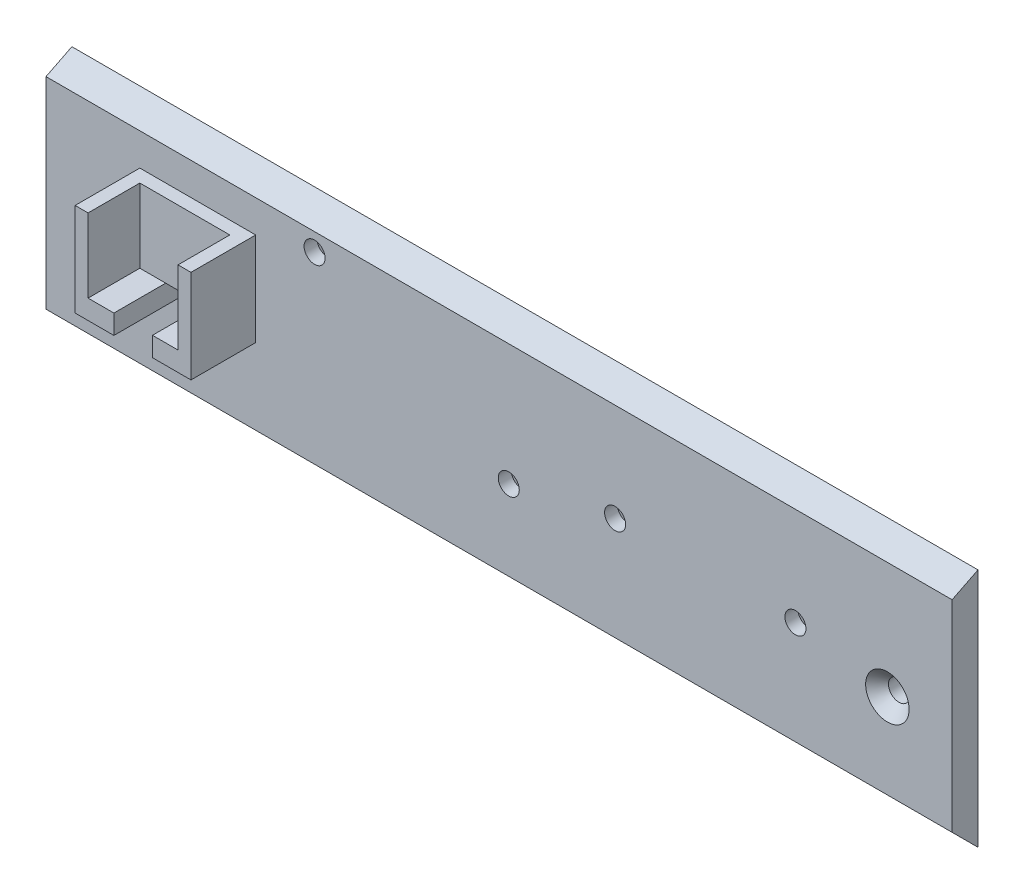
from build123d import *

# Parameters (mm, degrees)
CROQUIS1_W                      = 140
CROQUIS1_H                      = 37.125
CROQUIS1_R                      = 1.625
SALIENTE_EXTRUIR1_DEPTH         = 4
CROQUIS2_R                      = 3.35997123
CORTAR_EXTRUIR1_DEPTH           = 1.8
CORTAR_EXTRUIR1_DRAFT           = -44
CORTAR_EXTRUIR1_PROFILE_2_DEPTH = 1.8
CORTAR_EXTRUIR1_PROFILE_2_DRAFT = -44
CROQUIS3_R                      = 1.625
CORTAR_EXTRUIR2_DEPTH           = 4
SALIENTE_EXTRUIR2_DEPTH         = 10
CROQUIS6_W                      = 13.9
CROQUIS6_H                      = 11.4
SALIENTE_EXTRUIR4_DEPTH         = 2
CORTAR_EXTRUIR3_DEPTH           = 2
CORTAR_EXTRUIR4_START           = -140
CORTAR_EXTRUIR4_DEPTH           = 140


with BuildPart() as part:
    # Croquis1 → Saliente-Extruir1 (new body)
    with BuildSketch(Plane.XY):
        with Locations((62.679008317, -85.846623552)):
            Rectangle(CROQUIS1_W, CROQUIS1_H)
        with Locations((122.679008317, -87.284123552)):
            Circle(CROQUIS1_R, mode=Mode.SUBTRACT)
        with Locations((2.679008317, -87.284123552)):
            Circle(CROQUIS1_R, mode=Mode.SUBTRACT)
    extrude(amount=SALIENTE_EXTRUIR1_DEPTH)


with BuildPart() as cortar_extruir1_tool:
    # Croquis2 → Cortar-Extruir1 (with draft: the straight prism first)
    with BuildSketch(Plane.XY.offset(4)):
        with Locations((2.679008317, -87.284123552)):
            Circle(CROQUIS2_R)
    extrude(amount=-CORTAR_EXTRUIR1_DEPTH)
    # Cortar-Extruir1: the draft: its side faces are tilted about the plane it starts from
    cortar_extruir1_sides = [cortar_extruir1_tool.faces().sort_by_distance(p)[0] for p in [
        (-0.680962913, -87.284123552, 3.1),
    ]]
    draft(cortar_extruir1_sides, Plane.XY.offset(4), CORTAR_EXTRUIR1_DRAFT)


with BuildPart() as part_1:
    add(part.part)

    # Cortar-Extruir1: cut by cortar_extruir1_tool
    add(cortar_extruir1_tool.part, mode=Mode.SUBTRACT)


with BuildPart() as cortar_extruir1_profile_2_tool:
    # Croquis2 → Cortar-Extruir1 profile 2 (with draft: the straight prism first)
    with BuildSketch(Plane.XY.offset(4)):
        with Locations((122.679008317, -87.284123552)):
            Circle(CROQUIS2_R)
    extrude(amount=-CORTAR_EXTRUIR1_PROFILE_2_DEPTH)
    # Cortar-Extruir1 profile 2: the draft: its side faces are tilted about the plane it starts from
    cortar_extruir1_profile_2_sides = [cortar_extruir1_profile_2_tool.faces().sort_by_distance(p)[0] for p in [
        (119.319037087, -87.284123552, 3.1),
    ]]
    draft(cortar_extruir1_profile_2_sides, Plane.XY.offset(4), CORTAR_EXTRUIR1_PROFILE_2_DRAFT)


with BuildPart() as part_2:
    add(part_1.part)

    # Cortar-Extruir1 profile 2: cut by cortar_extruir1_profile_2_tool
    add(cortar_extruir1_profile_2_tool.part, mode=Mode.SUBTRACT)

    # Croquis3 → Cortar-Extruir2 (cut)
    with BuildSketch(Plane.XY.offset(4)):
        with Locations((80.609008317, -84.449123552)):
            Circle(CROQUIS3_R)
        with Locations((108.469008317, -84.454123552)):
            Circle(CROQUIS3_R)
        with Locations((34.179008317, -72.034123552)):
            Circle(CROQUIS3_R)
        with Locations((64.179008317, -88.034123552)):
            Circle(CROQUIS3_R)
    extrude(amount=-CORTAR_EXTRUIR2_DEPTH, mode=Mode.SUBTRACT)

    # Croquis4 → Saliente-Extruir2 (add)
    with BuildSketch(Plane.XY.offset(4)):
        Polygon((13.170968426, -85.674315594), (13.170968426, -88.674315594), (7.179008317, -88.674315594), (7.179008317, -74.274315594), (9.179008317, -74.274315594), (9.179008317, -85.674315594), align=None)
        Polygon((19.129008317, -85.674315594), (19.138778044, -88.674315594), (25.079008317, -88.674315594), (25.079008317, -74.274315594), (23.079008317, -74.274315594), (23.079008317, -85.674315594), align=None)
    extrude(amount=SALIENTE_EXTRUIR2_DEPTH)

    # Croquis6 → Saliente-Extruir4 (add)
    with BuildSketch(Plane.XY.offset(4)):
        with Locations((16.129008317, -79.974315594)):
            Rectangle(CROQUIS6_W, CROQUIS6_H)
    extrude(amount=SALIENTE_EXTRUIR4_DEPTH)

    # Croquis8 → Cortar-Extruir3 (cut)
    with BuildSketch(Plane(origin=(0, 0, 0), x_dir=(-1, 0, 0), z_dir=(0, 0, -1))):
        Polygon((-105.299008317, -84.454123552), (-106.884008317, -81.708823022), (-110.054008317, -81.708823022), (-111.639008317, -84.454123552), (-110.054008317, -87.199424082), (-106.884008317, -87.199424082), align=None)
        Polygon((-61.009008317, -88.034123552), (-62.594008317, -85.288823022), (-65.764008317, -85.288823022), (-67.349008317, -88.034123552), (-65.764008317, -90.779424082), (-62.594008317, -90.779424082), align=None)
        Polygon((-77.439008317, -84.449123552), (-79.024008317, -81.703823022), (-82.194008317, -81.703823022), (-83.779008317, -84.449123552), (-82.194008317, -87.194424082), (-79.024008317, -87.194424082), align=None)
        Polygon((-31.009008317, -72.034123552), (-32.594008317, -69.288823022), (-35.764008317, -69.288823022), (-37.349008317, -72.034123552), (-35.764008317, -74.779424082), (-32.594008317, -74.779424082), align=None)
    extrude(amount=-CORTAR_EXTRUIR3_DEPTH, mode=Mode.SUBTRACT)

    # Croquis9 → Cortar-Extruir4 (cut)
    with BuildSketch(Plane.ZY.offset(7.320991683).offset(CORTAR_EXTRUIR4_START)):
        Polygon((4, -104.409123552), (0, -104.409123552), (4, -100.409123552), align=None)
        Polygon((0, -67.284123552), (4, -67.284123552), (4, -69.284123552), align=None)
    extrude(amount=CORTAR_EXTRUIR4_DEPTH, mode=Mode.SUBTRACT)


solid = part_2.part
